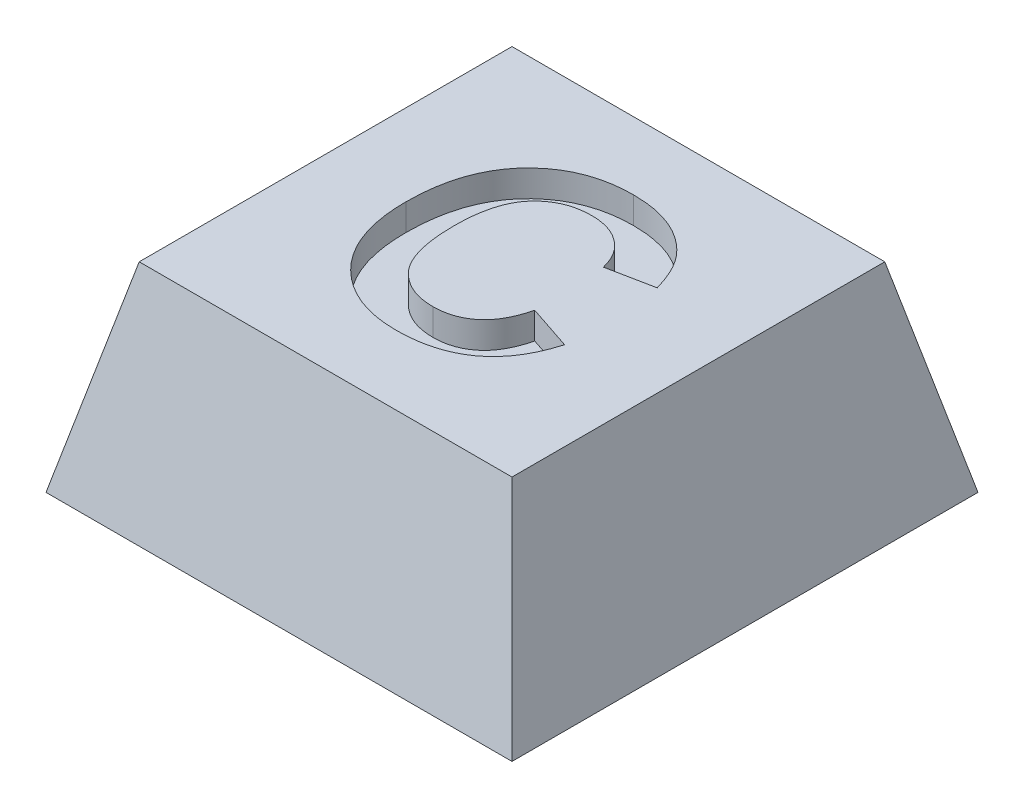
from build123d import *

# Parameters (mm, degrees)
SKETCH1_W           = 7
SKETCH1_H           = 7
BOSS_EXTRUDE1_DEPTH = 3
CUT_EXTRUDE1_DEPTH  = 7
CUT_EXTRUDE2_DEPTH  = 11
SKETCH4_R           = 1.8
CUT_EXTRUDE3_DEPTH  = 0.8
CUT_EXTRUDE4_DEPTH  = 0.4


with BuildPart() as part:
    # Sketch1 → Boss-Extrude1 (new body)
    with BuildSketch(Plane(origin=(0, 0, 0), x_dir=(1, 0, 0), z_dir=(0, 1, 0))):
        with Locations((3.5, 3.5)):
            Rectangle(SKETCH1_W, SKETCH1_H)
    extrude(amount=BOSS_EXTRUDE1_DEPTH)

    # Sketch2 → Cut-Extrude1 (cut)
    with BuildSketch(Plane.XY):
        Polygon((0, 0), (0.7, 3), (0, 3), align=None)
        Polygon((7, 0), (6.3, 3), (7, 3), align=None)
    extrude(amount=-CUT_EXTRUDE1_DEPTH, mode=Mode.SUBTRACT)

    # Sketch3 → Cut-Extrude2 (cut)
    with BuildSketch(Plane(origin=(0, 0, 0), x_dir=(0, 0, -1), z_dir=(1, 0, 0))):
        Polygon((0, 0), (0.7, 3), (0, 3), align=None)
        Polygon((7, 3), (6.3, 3), (7, 0), align=None)
    extrude(amount=CUT_EXTRUDE2_DEPTH, mode=Mode.SUBTRACT)

    # Sketch4 → Cut-Extrude3 (cut)
    with BuildSketch(Plane.XZ):
        with Locations(Location((3.5, -3.5, 0), (0, 0, 270))):
            Circle(SKETCH4_R)
    extrude(amount=-CUT_EXTRUDE3_DEPTH, mode=Mode.SUBTRACT)

    # Sketch5 → Cut-Extrude4 (cut)
    with BuildSketch(Plane(origin=(0, 3, 0), x_dir=(1, 0, 0), z_dir=(0, 1, 0))):
        with BuildLine():
            Line((4.301123745, 3.0403235), (4.974200669, 2.815964526))
            add(Edge.make_bspline(
                [(4.974200669, 2.815964526), (4.960521674, 2.771832567), (4.933733899, 2.68540831), (4.884547054, 2.561541828), (4.828302659, 2.446749112), (4.767023387, 2.33968659), (4.696898403, 2.243120033), (4.621853673, 2.15385218), (4.53965782, 2.073763183), (4.45071642, 2.002682023), (4.355885584, 1.939823406), (4.25406375, 1.886683329), (4.146770466, 1.840915158), (4.032917717, 1.803833291), (3.913261107, 1.774136343), (3.787239198, 1.754521348), (3.655441508, 1.741221733), (3.565448152, 1.739779731), (3.519372944, 1.739041449)],
                knots=[0, 0, 0, 0, 1.126640671, 2.206316847, 3.246446654, 4.24268115, 5.210795778, 6.153057602, 7.084219323, 8.004711971, 8.926421631, 9.854560063, 10.802134612, 11.768317461, 12.772025444, 13.805668576, 14.876536225, 16, 16, 16, 16], degree=3))
            add(Edge.make_bspline(
                [(3.519372944, 1.739041449), (3.462502515, 1.740217406), (3.350636682, 1.742530549), (3.187043495, 1.765815525), (3.031146586, 1.80214564), (2.882722932, 1.852444053), (2.742763243, 1.919064174), (2.609990608, 1.999266162), (2.485371298, 2.094678249), (2.3693425, 2.203692372), (2.263927531, 2.325476328), (2.172770854, 2.459372031), (2.094880625, 2.603493215), (2.031925726, 2.758527068), (1.982699244, 2.924314395), (1.948215991, 3.100625971), (1.926638564, 3.287517332), (1.924180264, 3.415596421), (1.922918617, 3.481329109)],
                knots=[0, 0, 0, 0, 1.025049111, 2.016302254, 2.973197159, 3.90886983, 4.83646737, 5.763135642, 6.70136783, 7.661478232, 8.629732022, 9.600038443, 10.576877021, 11.5787097, 12.612181225, 13.690866959, 14.814907849, 16, 16, 16, 16], degree=3))
            add(Edge.make_bspline(
                [(1.922918617, 3.481329109), (1.924174578, 3.550566485), (1.926624727, 3.685635974), (1.948242577, 3.882015446), (1.981803001, 4.067091651), (2.031112683, 4.239717041), (2.09314245, 4.401106495), (2.171127245, 4.549657913), (2.261374638, 4.687351889), (2.366311182, 4.811664664), (2.482868768, 4.922037599), (2.607774637, 5.019637111), (2.74219405, 5.101516105), (2.885391432, 5.168472462), (3.037558838, 5.220286586), (3.198396842, 5.257596822), (3.368037039, 5.279313779), (3.484020884, 5.282359114), (3.543211085, 5.283913244)],
                knots=[0, 0, 0, 0, 1.212648312, 2.365655595, 3.457000981, 4.504219827, 5.506356588, 6.480637568, 7.437950897, 8.385265166, 9.323599949, 10.245787653, 11.157260172, 12.074946661, 13.00980897, 13.968233668, 14.963125779, 16, 16, 16, 16], degree=3))
            add(Edge.make_bspline(
                [(3.543211085, 5.283913244), (3.594904175, 5.282610712), (3.696255358, 5.280056925), (3.844673873, 5.262706402), (3.98533309, 5.232257393), (4.118993318, 5.191158002), (4.244893689, 5.136917739), (4.363259754, 5.070636697), (4.474498364, 4.992665569), (4.541521917, 4.931760883), (4.575262367, 4.901100744)],
                knots=[0, 0, 0, 0, 1.098510076, 2.153775193, 3.169777012, 4.153122333, 5.120892526, 6.076995459, 7.031936742, 8, 8, 8, 8], degree=3))
            add(Edge.make_bspline(
                [(4.575262367, 4.901100744), (4.594817889, 4.881591385), (4.634388278, 4.842114408), (4.687225854, 4.775466084), (4.73732244, 4.703719152), (4.783882904, 4.625649701), (4.825435673, 4.54066776), (4.863980304, 4.45007838), (4.8994669, 4.353532371), (4.919201528, 4.286342314), (4.929328874, 4.251861961)],
                knots=[0, 0, 0, 0, 0.885292881, 1.791380647, 2.722937556, 3.69093542, 4.703306561, 5.754477758, 6.847650944, 8, 8, 8, 8], degree=3))
            Line((4.929328874, 4.251861961), (4.256251951, 4.117246577))
            add(Edge.make_bspline(
                [(4.256251951, 4.117246577), (4.250531073, 4.139323539), (4.239262446, 4.182809362), (4.216461913, 4.245296102), (4.190307903, 4.304590437), (4.157892404, 4.359240043), (4.123458761, 4.411676126), (4.082691271, 4.459570361), (4.038193489, 4.504177952), (3.98964486, 4.545035979), (3.937624153, 4.581318844), (3.883132951, 4.61393488), (3.825180855, 4.640559757), (3.76453877, 4.66209922), (3.701448228, 4.680158437), (3.63534753, 4.691314457), (3.566804403, 4.699878675), (3.520103543, 4.700342739), (3.496235925, 4.70057991)],
                knots=[0, 0, 0, 0, 1.051226935, 2.070641259, 3.064374968, 4.034983734, 4.997599858, 5.953980297, 6.92954377, 7.901109626, 8.875958313, 9.851998019, 10.826131395, 11.811470594, 12.818270757, 13.847890818, 14.900111925, 16, 16, 16, 16], degree=3))
            add(Edge.make_bspline(
                [(3.496235925, 4.70057991), (3.463458178, 4.699917949), (3.399485824, 4.698625999), (3.305980427, 4.684221631), (3.216859157, 4.664118846), (3.132481433, 4.633421996), (3.053369786, 4.594160979), (2.978625107, 4.546434822), (2.908657635, 4.490447949), (2.843443721, 4.425537099), (2.784923098, 4.350528652), (2.733475117, 4.265267743), (2.690794404, 4.168786384), (2.656144454, 4.062031362), (2.628870995, 3.944748811), (2.609395598, 3.81678831), (2.598625118, 3.678062323), (2.596890981, 3.582075039), (2.59599554, 3.532511)],
                knots=[0, 0, 0, 0, 0.938194206, 1.831074359, 2.704771284, 3.551924377, 4.396294915, 5.230222094, 6.087631332, 6.958733431, 7.860107878, 8.806247581, 9.804197948, 10.875520245, 12.017191412, 13.250061517, 14.580040491, 16, 16, 16, 16], degree=3))
            add(Edge.make_bspline(
                [(2.59599554, 3.532511), (2.596882163, 3.479909852), (2.598590549, 3.378555543), (2.609358744, 3.232361327), (2.628958677, 3.097901323), (2.655869672, 2.974936912), (2.690694237, 2.863543412), (2.733302771, 2.763913587), (2.783956188, 2.675930758), (2.84257568, 2.599653514), (2.907679246, 2.534131595), (2.977503606, 2.477797664), (3.05163681, 2.429632374), (3.130524959, 2.39000508), (3.2144681, 2.360027472), (3.302776345, 2.338287186), (3.395773712, 2.32446654), (3.459494346, 2.323081807), (3.492029194, 2.322374782)],
                knots=[0, 0, 0, 0, 1.475208372, 2.842499301, 4.107722225, 5.282836115, 6.369007568, 7.375918121, 8.315702116, 9.208439171, 10.065831443, 10.90006451, 11.71996243, 12.54067204, 13.369972975, 14.214060185, 15.088124569, 16, 16, 16, 16], degree=3))
            add(Edge.make_bspline(
                [(3.492029194, 2.322374782), (3.516116809, 2.32297573), (3.563481527, 2.324157405), (3.633490233, 2.331657405), (3.700684312, 2.345970073), (3.765392659, 2.364895987), (3.827866687, 2.388642426), (3.887153461, 2.419104331), (3.944419425, 2.454115768), (3.998476353, 2.495146489), (4.050048096, 2.541211307), (4.097084586, 2.594450756), (4.140714836, 2.653585613), (4.180385329, 2.719011076), (4.217421584, 2.790167129), (4.248932218, 2.868162419), (4.278287198, 2.951736508), (4.293378607, 3.010278741), (4.301123745, 3.0403235)],
                knots=[0, 0, 0, 0, 0.980177776, 1.927374078, 2.859849964, 3.771585772, 4.668674471, 5.574490016, 6.479656464, 7.396337719, 8.332153134, 9.288470092, 10.28125149, 11.318486971, 12.398724812, 13.541284404, 14.738150009, 16, 16, 16, 16], degree=3))
        make_face()
    extrude(amount=-CUT_EXTRUDE4_DEPTH, mode=Mode.SUBTRACT)


solid = part.part
